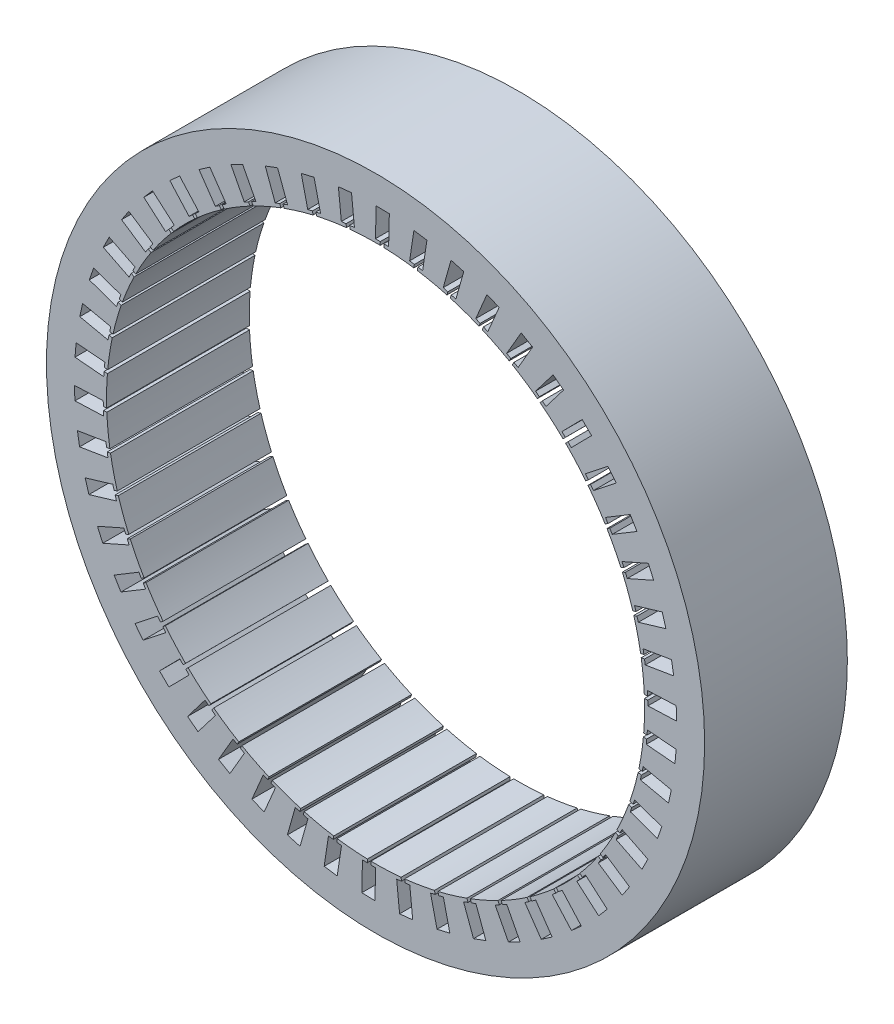
from build123d import *

# Parameters (mm, degrees)
ROTOR_STACK_START    = -20
SKETCH_1_R           = 92.246153846
SKETCH_1_R_2         = 75.4
ROTOR_STACK_DEPTH    = 40
ROTOR_50_SLOTS_DEPTH = 21


with BuildPart() as part:
    # Эскиз1 → Rotor_stack (new body)
    with BuildSketch(Plane.XY.offset(ROTOR_STACK_START)):
        Circle(SKETCH_1_R)
        Circle(SKETCH_1_R_2, mode=Mode.SUBTRACT)
    extrude(amount=ROTOR_STACK_DEPTH)

    # Эскиз2 → Rotor_50_slots (cut, symmetric)
    with BuildSketch(Plane.XY):
        Polygon((74.561201127, 2.40567798), (76.284645138, 2.472850014), (76.337072307, 1.127717467), (84.40786759, 1.44228048), (84.264067355, 5.131786895), (76.193272072, 4.817223882), (76.245699241, 3.472091335), (74.52225523, 3.404919301), align=None)
        Polygon((73.671752385, 11.731704926), (75.373187637, 12.0143521), (75.593791214, 10.686397191), (83.561520666, 12.01001865), (82.95643657, 15.652409257), (74.988707118, 14.328787798), (75.209310695, 13.000832889), (73.507875443, 12.718185715), align=None)
        Polygon((71.620456099, 20.872715877), (73.273049942, 21.366380676), (73.658350876, 20.076546048), (81.397358644, 22.388351653), (80.340533225, 25.926183775), (72.601525457, 23.61437817), (72.986826391, 22.324543542), (71.334232548, 21.830878744), align=None)
        Polygon((68.439662437, 29.684551631), (70.017352478, 30.381448665), (70.561274344, 29.15007578), (77.949511652, 32.413606975), (76.457611677, 35.791086888), (69.069374369, 32.527555692), (69.613296235, 31.296182808), (68.035606194, 30.599285774), align=None)
        Polygon((64.179534414, 38.028244272), (65.657439539, 38.917383059), (66.351404364, 37.763891404), (73.272354297, 41.927680353), (71.36890792, 45.09154318), (64.447957987, 40.92775423), (65.141922812, 39.774262575), (63.664017687, 38.885123787), align=None)
        Polygon((58.907256794, 45.772208784), (60.262069557, 46.839567075), (61.095133101, 45.782147901), (67.439648143, 50.780529165), (65.154673851, 53.680878899), (58.810158809, 48.682497635), (59.643222353, 47.625078461), (58.28840959, 46.55772017), align=None)
        Polygon((52.705976545, 52.794318221), (53.916330739, 54.023063137), (54.875355092, 53.078392577), (60.543378452, 58.832538698), (57.912911654, 61.423635091), (52.244888294, 55.66948897), (53.203912648, 54.72481841), (51.993558454, 53.496073494), align=None)
        Polygon((45.673491561, 58.983829721), (46.720299177, 60.354583221), (47.790159953, 59.537559294), (52.692303516, 65.95672395), (49.757828245, 68.197703865), (44.855684682, 61.778539209), (45.925545458, 60.961515282), (44.878737842, 59.590761782), align=None)
        Polygon((37.920708331, 64.243130992), (38.787460588, 65.734275475), (39.951285442, 65.057783136), (44.010239476, 72.040732265), (40.81803416, 73.896254109), (36.759080126, 66.91330498), (37.922904981, 66.236812641), (37.056152725, 64.745668158), align=None)
        Polygon((29.569892878, 68.48927971), (30.242920574, 70.077298936), (31.482355295, 69.552006873), (34.63410767, 76.988615197), (31.234515293, 78.429416283), (28.082762918, 70.992807959), (29.322197639, 70.467515896), (28.649169943, 68.87949667), align=None)
        Polygon((20.75274255, 71.655311573), (21.221431637, 73.315161531), (22.516929598, 72.949353914), (24.711775296, 80.722341677), (21.158409462, 81.72569971), (18.963563764, 73.952711948), (20.259061724, 73.586904331), (19.790372637, 71.927054374), align=None)
        Polygon((11.608309075, 73.691296368), (11.865268047, 75.396800232), (13.19639847, 75.196246066), (14.399723463, 83.183028607), (10.748622873, 83.733120032), (9.54529788, 75.746337492), (10.876428303, 75.545783326), (10.619469332, 73.840279463), align=None)
        Polygon((2.280805632, 74.565125398), (2.321982091, 76.289386353), (3.667752255, 76.257248498), (3.86057939, 84.331869485), (0.169324081, 84.420019032), (-0.023503053, 76.345398045), (1.322267111, 76.313260189), (1.281090652, 74.588999234), align=None)
        Polygon((-7.082667479, 74.263017858), (-7.25792291, 75.978843279), (-5.918736604, 76.115628566), (-6.739448327, 84.150746404), (-10.412645052, 83.775563902), (-9.591933329, 75.740446064), (-8.252747023, 75.877231352), (-8.077491593, 74.16140593), align=None)
        Polygon((-16.334442693, 72.789738163), (-16.723366131, 74.470068459), (-15.411883451, 74.773619703), (-17.233190917, 82.642515782), (-20.830400554, 81.809918083), (-19.009093087, 73.941022004), (-17.697610407, 74.244573249), (-17.30868697, 72.564242953), align=None)
        Polygon((-25.328613988, 70.168520816), (-25.925071877, 71.786856173), (-24.661975689, 72.25238619), (-27.455155793, 79.830963319), (-30.919648194, 78.554080986), (-28.126468091, 70.975503857), (-26.863371903, 71.441033874), (-26.266914013, 69.822698517), align=None)
        Polygon((-33.92333791, 66.440703978), (-34.717923754, 67.971522281), (-33.523133839, 68.591689385), (-37.24413646, 75.760428875), (-40.521274513, 74.059399106), (-36.800271892, 66.890659615), (-35.605481976, 67.510826719), (-34.810896132, 65.980008415), align=None)
        Polygon((-41.983070528, 61.665077549), (-42.963253233, 63.084236879), (-41.855612142, 63.849260663), (-46.445754847, 70.495107211), (-49.483856126, 68.39675626), (-44.893713421, 61.750909713), (-43.786072329, 62.515933497), (-42.805889624, 61.096774166), align=None)
        Polygon((-49.380705044, 55.916956009), (-50.531026544, 57.202075377), (-49.528002438, 58.09989096), (-54.914895935, 64.118035595), (-57.666047768, 61.655455711), (-52.279154271, 55.637311076), (-51.276130165, 56.535126658), (-50.125808665, 55.250007291), align=None)
        Polygon((-55.999576343, 49.286990671), (-57.30189538, 50.417802975), (-56.419306549, 51.434251268), (-62.517996309, 56.729784255), (-64.938811388, 53.941811793), (-58.840121629, 48.646278807), (-57.957532798, 49.6627271), (-56.65521376, 48.531914796), align=None)
        Polygon((-61.735300871, 41.879740047), (-63.169079096, 42.838411702), (-62.420844493, 43.957462709), (-69.135150535, 48.446870328), (-71.18745116, 45.37747328), (-64.473145119, 40.888065662), (-63.724910515, 42.007116668), (-62.29113229, 41.048445013), align=None)
        Polygon((-66.497422825, 33.812020904), (-68.040048699, 34.583433086), (-67.43796843, 35.787438704), (-74.662002137, 39.399920316), (-76.313422303, 36.097504907), (-69.089388596, 32.485023295), (-68.487308327, 33.689028913), (-66.944682453, 32.917616731), align=None)
        Polygon((-70.210840697, 25.211065994), (-71.837986089, 25.783053072), (-71.39155532, 27.053025412), (-79.011389365, 29.731610024), (-80.235885188, 26.248257317), (-72.616051143, 23.569672706), (-72.169620374, 24.839645047), (-70.542474983, 24.26765797), align=None)
        Polygon((-72.81699167, 16.212517513), (-74.502995524, 16.576058908), (-74.219254736, 17.891969749), (-82.114719784, 19.594414481), (-82.892980233, 15.98505903), (-74.997515184, 14.282614299), (-74.713774396, 15.59852514), (-73.027770542, 15.234983745), align=None)
        Polygon((-74.274775186, 6.958287945), (-75.993048214, 7.107650393), (-75.876472167, 8.448747035), (-83.923052019, 9.148203316), (-84.242803461, 5.469766813), (-76.19622361, 4.770310531), (-76.079647563, 6.111407173), (-74.361374535, 5.962044726), align=None)
        Polygon((-74.561201127, -2.40567798), (-76.284645138, -2.472850014), (-76.337072307, -1.127717467), (-84.40786759, -1.44228048), (-84.264067355, -5.131786895), (-76.193272072, -4.817223882), (-76.245699241, -3.472091335), (-74.52225523, -3.404919301), align=None)
        Polygon((-73.671752385, -11.731704926), (-75.373187637, -12.0143521), (-75.593791214, -10.686397191), (-83.561520666, -12.01001865), (-82.95643657, -15.652409257), (-74.988707118, -14.328787798), (-75.209310695, -13.000832889), (-73.507875443, -12.718185715), align=None)
        Polygon((-71.620456099, -20.872715877), (-73.273049942, -21.366380676), (-73.658350876, -20.076546048), (-81.397358644, -22.388351653), (-80.340533225, -25.926183775), (-72.601525457, -23.61437817), (-72.986826391, -22.324543542), (-71.334232548, -21.830878744), align=None)
        Polygon((-68.439662437, -29.684551631), (-70.017352478, -30.381448665), (-70.561274344, -29.15007578), (-77.949511652, -32.413606975), (-76.457611677, -35.791086888), (-69.069374369, -32.527555692), (-69.613296235, -31.296182808), (-68.035606194, -30.599285774), align=None)
        Polygon((-64.179534414, -38.028244272), (-65.657439539, -38.917383059), (-66.351404364, -37.763891404), (-73.272354297, -41.927680353), (-71.36890792, -45.09154318), (-64.447957987, -40.92775423), (-65.141922812, -39.774262575), (-63.664017687, -38.885123787), align=None)
        Polygon((-58.907256794, -45.772208784), (-60.262069557, -46.839567075), (-61.095133101, -45.782147901), (-67.439648143, -50.780529165), (-65.154673851, -53.680878899), (-58.810158809, -48.682497635), (-59.643222353, -47.625078461), (-58.28840959, -46.55772017), align=None)
        Polygon((-52.705976545, -52.794318221), (-53.916330739, -54.023063137), (-54.875355092, -53.078392577), (-60.543378452, -58.832538698), (-57.912911654, -61.423635091), (-52.244888294, -55.66948897), (-53.203912648, -54.72481841), (-51.993558454, -53.496073494), align=None)
        Polygon((-45.673491561, -58.983829721), (-46.720299177, -60.354583221), (-47.790159953, -59.537559294), (-52.692303516, -65.95672395), (-49.757828245, -68.197703865), (-44.855684682, -61.778539209), (-45.925545458, -60.961515282), (-44.878737842, -59.590761782), align=None)
        Polygon((-37.920708331, -64.243130992), (-38.787460588, -65.734275475), (-39.951285442, -65.057783136), (-44.010239476, -72.040732265), (-40.81803416, -73.896254109), (-36.759080126, -66.91330498), (-37.922904981, -66.236812641), (-37.056152725, -64.745668158), align=None)
        Polygon((-29.569892878, -68.48927971), (-30.242920574, -70.077298936), (-31.482355295, -69.552006873), (-34.63410767, -76.988615197), (-31.234515293, -78.429416283), (-28.082762918, -70.992807959), (-29.322197639, -70.467515896), (-28.649169943, -68.87949667), align=None)
        Polygon((-20.75274255, -71.655311573), (-21.221431637, -73.315161531), (-22.516929598, -72.949353914), (-24.711775296, -80.722341677), (-21.158409462, -81.72569971), (-18.963563764, -73.952711948), (-20.259061724, -73.586904331), (-19.790372637, -71.927054374), align=None)
        Polygon((-11.608309075, -73.691296368), (-11.865268047, -75.396800232), (-13.19639847, -75.196246066), (-14.399723463, -83.183028607), (-10.748622873, -83.733120032), (-9.54529788, -75.746337492), (-10.876428303, -75.545783326), (-10.619469332, -73.840279463), align=None)
        Polygon((-2.280805632, -74.565125398), (-2.321982091, -76.289386353), (-3.667752255, -76.257248498), (-3.86057939, -84.331869485), (-0.169324081, -84.420019032), (0.023503053, -76.345398045), (-1.322267111, -76.313260189), (-1.281090652, -74.588999234), align=None)
        Polygon((7.082667479, -74.263017858), (7.25792291, -75.978843279), (5.918736604, -76.115628566), (6.739448327, -84.150746404), (10.412645052, -83.775563902), (9.591933329, -75.740446064), (8.252747023, -75.877231352), (8.077491593, -74.16140593), align=None)
        Polygon((16.334442693, -72.789738163), (16.723366131, -74.470068459), (15.411883451, -74.773619703), (17.233190917, -82.642515782), (20.830400554, -81.809918083), (19.009093087, -73.941022004), (17.697610407, -74.244573249), (17.30868697, -72.564242953), align=None)
        Polygon((25.328613988, -70.168520816), (25.925071877, -71.786856173), (24.661975689, -72.25238619), (27.455155793, -79.830963319), (30.919648194, -78.554080986), (28.126468091, -70.975503857), (26.863371903, -71.441033874), (26.266914013, -69.822698517), align=None)
        Polygon((33.92333791, -66.440703978), (34.717923754, -67.971522281), (33.523133839, -68.591689385), (37.24413646, -75.760428875), (40.521274513, -74.059399106), (36.800271892, -66.890659615), (35.605481976, -67.510826719), (34.810896132, -65.980008415), align=None)
        Polygon((41.983070528, -61.665077549), (42.963253233, -63.084236879), (41.855612142, -63.849260663), (46.445754847, -70.495107211), (49.483856126, -68.39675626), (44.893713421, -61.750909713), (43.786072329, -62.515933497), (42.805889624, -61.096774166), align=None)
        Polygon((49.380705044, -55.916956009), (50.531026544, -57.202075377), (49.528002438, -58.09989096), (54.914895935, -64.118035595), (57.666047768, -61.655455711), (52.279154271, -55.637311076), (51.276130165, -56.535126658), (50.125808665, -55.250007291), align=None)
        Polygon((55.999576343, -49.286990671), (57.30189538, -50.417802975), (56.419306549, -51.434251268), (62.517996309, -56.729784255), (64.938811388, -53.941811793), (58.840121629, -48.646278807), (57.957532798, -49.6627271), (56.65521376, -48.531914796), align=None)
        Polygon((61.735300871, -41.879740047), (63.169079096, -42.838411702), (62.420844493, -43.957462709), (69.135150535, -48.446870328), (71.18745116, -45.37747328), (64.473145119, -40.888065662), (63.724910515, -42.007116668), (62.29113229, -41.048445013), align=None)
        Polygon((66.497422825, -33.812020904), (68.040048699, -34.583433086), (67.43796843, -35.787438704), (74.662002137, -39.399920316), (76.313422303, -36.097504907), (69.089388596, -32.485023295), (68.487308327, -33.689028913), (66.944682453, -32.917616731), align=None)
        Polygon((70.210840697, -25.211065994), (71.837986089, -25.783053072), (71.39155532, -27.053025412), (79.011389365, -29.731610024), (80.235885188, -26.248257317), (72.616051143, -23.569672706), (72.169620374, -24.839645047), (70.542474983, -24.26765797), align=None)
        Polygon((72.81699167, -16.212517513), (74.502995524, -16.576058908), (74.219254736, -17.891969749), (82.114719784, -19.594414481), (82.892980233, -15.98505903), (74.997515184, -14.282614299), (74.713774396, -15.59852514), (73.027770542, -15.234983745), align=None)
        Polygon((74.274775186, -6.958287945), (75.993048214, -7.107650393), (75.876472167, -8.448747035), (83.923052019, -9.148203316), (84.242803461, -5.469766813), (76.19622361, -4.770310531), (76.079647563, -6.111407173), (74.361374535, -5.962044726), align=None)
    extrude(amount=ROTOR_50_SLOTS_DEPTH, both=True, mode=Mode.SUBTRACT)


solid = part.part
